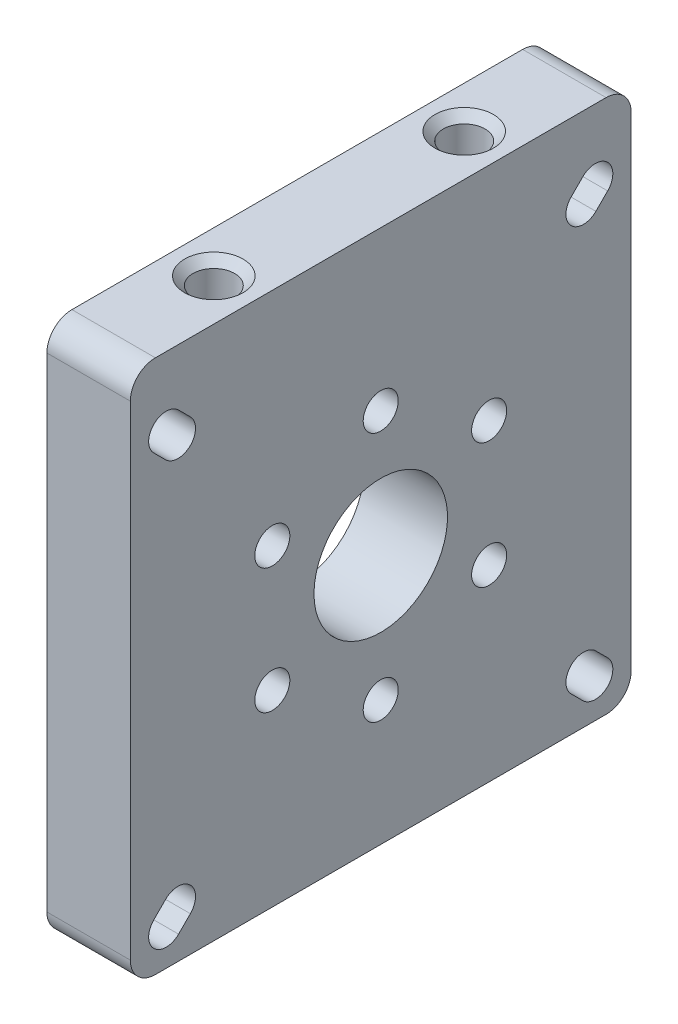
from build123d import *

# Parameters (mm, degrees)
SKETCH_1_W                  = 10
SKETCH_1_H                  = 42
CUT_EXTRUDE_4_DEPTH         = 72.414284285
CUT_EXTRUDE_4_DEPTH_BACK    = 72.414284285
SKETCH_7_R                  = 50
SKETCH_7_W                  = 60
SKETCH_7_H                  = 64
CUT_EXTRUDE_2_REACH         = 48.433
SKETCH_5_R                  = 2.1
PATTERN_CIRCULAR_1_COUNT    = 6
CUT_EXTRUDE_3_DEPTH         = 47.432747065
PATTERN_CIRCULAR_2_COUNT    = 4
HOLE_WIZARD_M61_D           = 5
HOLE_WIZARD_M61_DEPTH       = 17
HOLE_WIZARD_M61_CSINK_D     = 7
HOLE_WIZARD_M61_CSINK_ANGLE = 90
HOLE_WIZARD_M61_TIP         = 1.502151548
CHAMFER_1_SIZE              = 2
FILLET_1_R                  = 3


with BuildPart() as part:
    # Эскиз1 → Повернуть1 (revolve)
    with BuildSketch(Plane.XY, mode=Mode.PRIVATE) as revolve_1_sk:
        with Locations((5, 29)):
            Rectangle(SKETCH_1_W, SKETCH_1_H)
    revolve(revolve_1_sk.sketch.rotate(Axis((-29.36512031, 0, 0), (1, 0, 0)), 90), axis=Axis((-29.36512031, 0, 0), (1, 0, 0)))

    # Эскиз7 → Вырез-Вытянуть4 (cut, two sides: drawn at the far end of the back side and taken through both)
    with BuildSketch(Plane.ZY.offset(-CUT_EXTRUDE_4_DEPTH_BACK)):
        Circle(SKETCH_7_R)
        with Locations((0, 2)):
            Rectangle(SKETCH_7_W, SKETCH_7_H, mode=Mode.SUBTRACT)
    extrude(amount=CUT_EXTRUDE_4_DEPTH + CUT_EXTRUDE_4_DEPTH_BACK, mode=Mode.SUBTRACT)

    # Эскиз5 → Вырез-Вытянуть2 (cut, up to next)
    with BuildSketch(Plane.ZY, mode=Mode.PRIVATE) as cut_extrude_2_sk1:
        with Locations((0, 15)):
            Circle(SKETCH_5_R)
    cut_extrude_2_tool1 = extrude(cut_extrude_2_sk1.sketch, amount=-CUT_EXTRUDE_2_REACH, mode=Mode.PRIVATE) & part.part
    cut_extrude_2 = cut_extrude_2_tool1.solids().sort_by_distance((0, 15, 0))[0]
    add(cut_extrude_2, mode=Mode.SUBTRACT)

    # Круговой массив1: Вырез-Вытянуть2 ×6 about axis
    pattern_circular_1_axis = Axis((0, 0, 0), (1, 0, 0))
    for i in range(1, PATTERN_CIRCULAR_1_COUNT):
        add(cut_extrude_2.rotate(pattern_circular_1_axis, i * 360 / PATTERN_CIRCULAR_1_COUNT), mode=Mode.SUBTRACT)

    # Эскиз6 → Вырез-Вытянуть3 (cut, symmetric)
    with BuildSketch(Plane.ZY):
        with BuildLine():
            Line((-27.192031022, 24.222182541), (-25.777817459, 22.807968978))
            ThreePointArc((-25.777817459, 22.807968978), (-22.807968978, 22.807968978), (-22.807968978, 25.777817459))
            Line((-22.807968978, 25.777817459), (-24.222182541, 27.192031022))
            ThreePointArc((-24.222182541, 27.192031022), (-27.192031022, 27.192031022), (-27.192031022, 24.222182541))
        make_face()
    cut_extrude_3 = extrude(amount=CUT_EXTRUDE_3_DEPTH, both=True, mode=Mode.SUBTRACT)

    # Круговой массив2: Вырез-Вытянуть3 ×4 about axis
    pattern_circular_2_axis = Axis((0, 0, 0), (1, 0, 0))
    for i in range(1, PATTERN_CIRCULAR_2_COUNT):
        add(cut_extrude_3.rotate(pattern_circular_2_axis, i * 360 / PATTERN_CIRCULAR_2_COUNT), mode=Mode.SUBTRACT)

    # Отверстие обработанное метчиком M61
    with Locations(Plane(origin=(0, 34, 0), x_dir=(1, 0, 0), z_dir=(0, 1, 0))):
        with Locations((5, 15), (5, -15)):
            CounterSinkHole(HOLE_WIZARD_M61_D / 2, HOLE_WIZARD_M61_CSINK_D / 2, depth=HOLE_WIZARD_M61_DEPTH, counter_sink_angle=HOLE_WIZARD_M61_CSINK_ANGLE)
            with Locations((0, 0, -(HOLE_WIZARD_M61_DEPTH + HOLE_WIZARD_M61_TIP / 2))):  # 118° drill point
                Cone(0, HOLE_WIZARD_M61_D / 2, HOLE_WIZARD_M61_TIP, mode=Mode.SUBTRACT)

    # Фаска1
    chamfer_1_edges = [part.edges().sort_by_distance(p)[0] for p in [
        (0, 15, -2.1),
        (0, 9.318653348, 11.940381057),
        (0, -5.681346652, 14.040381057),
        (0, -15, 2.1),
        (0, -9.318653348, -11.940381057),
        (0, 5.681346652, -14.040381057),
    ]]
    chamfer(chamfer_1_edges, length=CHAMFER_1_SIZE)

    # Скругление1
    fillet_1_edges = [part.edges().sort_by_distance(p)[0] for p in [
        (5, 34, -30),
        (5, 34, 30),
        (5, -30, 30),
        (5, -30, -30),
    ]]
    fillet(fillet_1_edges, radius=FILLET_1_R)


solid = part.part
